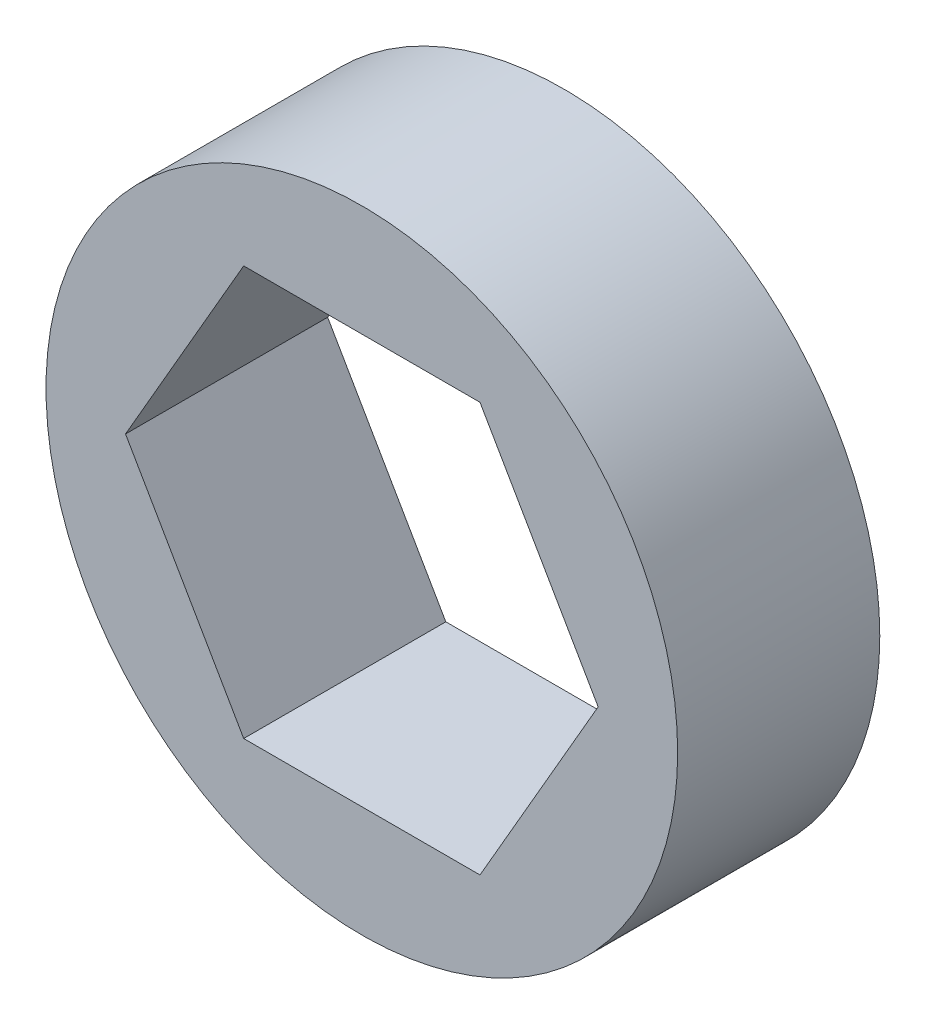
from build123d import *

# Parameters (mm, degrees)
SKETCH1_R           = 7.9375
BOSS_EXTRUDE1_DEPTH = 5.08


with BuildPart() as part:
    # Sketch1 → Boss-Extrude1 (new body)
    with BuildSketch(Plane.XY):
        Circle(SKETCH1_R)
        Polygon((2.96960111, -5.1435), (5.939202219, 0), (2.96960111, 5.1435), (-2.96960111, 5.1435), (-5.939202219, 0), (-2.96960111, -5.1435), align=None, mode=Mode.SUBTRACT)
    extrude(amount=BOSS_EXTRUDE1_DEPTH)


solid = part.part
